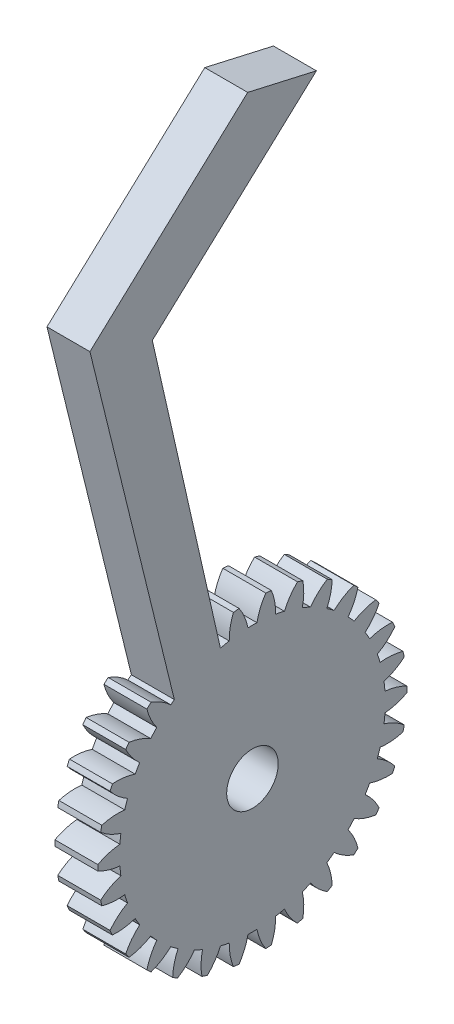
from build123d import *

# Parameters (mm, degrees)
BASPROSKE_W        = 5
BASPROSKE_H        = 18
TOOTHCUT_DEPTH     = 26.942243542
TEETHCUTS_COUNT    = 30
BORSKE_R           = 3
BORE_DEPTH         = 50.0000508
BOSS_EXTRU_1_DEPTH = 5


with BuildPart() as part:
    # BasProSke → Base-Revolve (revolve)
    with BuildSketch(Plane(origin=(0, 0, 0), x_dir=(1, 0, 0), z_dir=(0, 1, 0)), mode=Mode.PRIVATE) as base_revolve_sk:
        with Locations((2.5, 9)):
            Rectangle(BASPROSKE_W, BASPROSKE_H)
    revolve(base_revolve_sk.sketch.rotate(Axis((-10, 0, 0), (1, 0, 0)), 180), axis=Axis((-10, 0, 0), (1, 0, 0)))

    # TooCutSke → ToothCut (cut, through all)
    with BuildSketch(Plane(origin=(0, 0, 0), x_dir=(0, 0, -1), z_dir=(1, 0, 0))):
        with BuildLine():
            ThreePointArc((0.523521522, 15.458887906), (0, 15.46775), (-0.523521522, 15.458887906))
            ThreePointArc((-0.523521522, 15.458887906), (-0.919551256, 16.760900189), (-1.568701479, 17.957010353))
            ThreePointArc((-1.568701479, 17.957010353), (0, 18.0254), (1.568701479, 17.957010353))
            ThreePointArc((1.568701479, 17.957010353), (0.919551256, 16.760900189), (0.523521522, 15.458887906))
        make_face()
    toothcut = extrude(amount=TOOTHCUT_DEPTH, mode=Mode.SUBTRACT)

    # TeethCuts: ToothCut ×30 about axis
    teethcuts_axis = Axis((0, 0, 0), (1, 0, 0))
    for i in range(1, TEETHCUTS_COUNT):
        add(toothcut.rotate(teethcuts_axis, i * 360 / TEETHCUTS_COUNT), mode=Mode.SUBTRACT)

    # BorSke → Bore (cut, symmetric)
    with BuildSketch(Plane(origin=(0, 0, 0), x_dir=(0, 0, -1), z_dir=(1, 0, 0))):
        with Locations(Location((0, 0, 0), (0, 0, 180))):
            Circle(BORSKE_R)
    extrude(amount=BORE_DEPTH, both=True, mode=Mode.SUBTRACT)

    # Esquisse2 → Boss.-Extru.1 (add)
    with BuildSketch(Plane(origin=(5, 0, 0), x_dir=(0, 0, -1), z_dir=(1, 0, 0))):
        Polygon((-3.726164843, 15.01222787), (-11.656542396, 50.01222787), (7.45003198, 67.64568515), (-0.54996802, 69.468919999), (-18.921674151, 52.513672615), (-9.091715336, 12.513672615), align=None)
    extrude(amount=-BOSS_EXTRU_1_DEPTH)


solid = part.part
